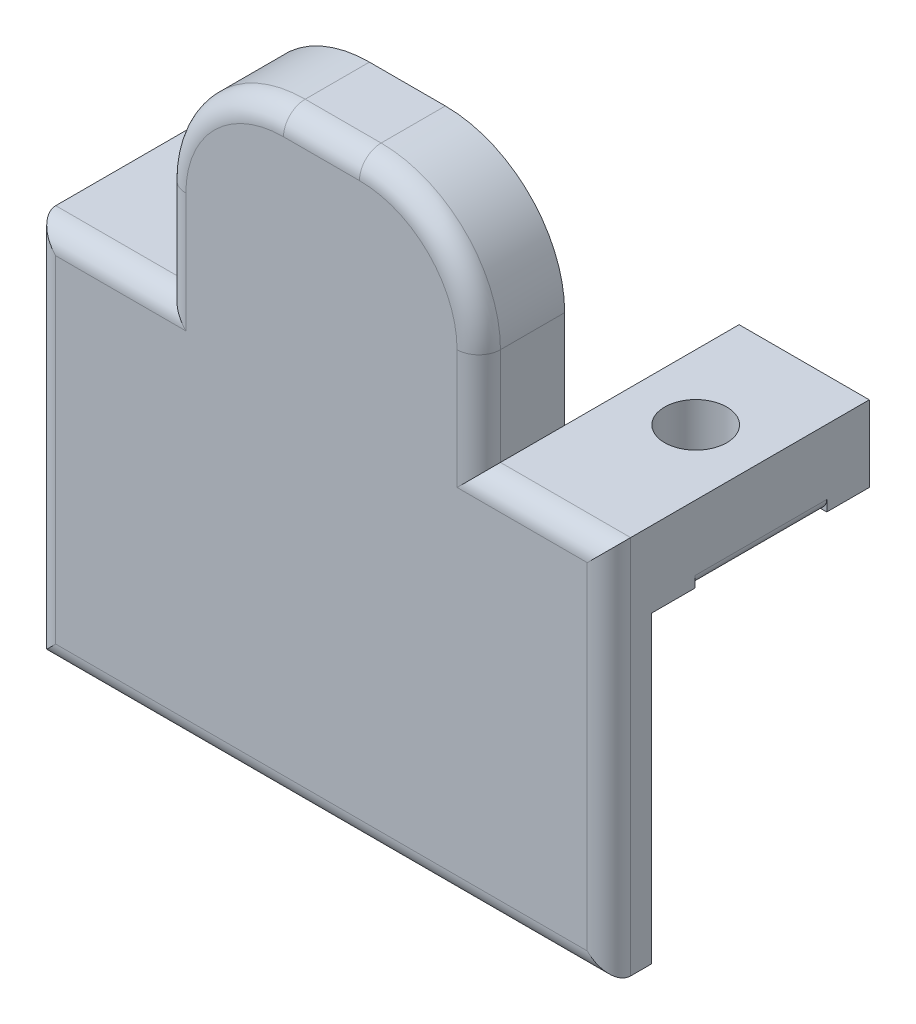
from build123d import *

# Parameters (mm, degrees)
SKETCH_1_W           = 53
SKETCH_1_H           = 35
EXTRUDE_1_DEPTH      = 3.92
SKETCH_2_W           = 12
SKETCH_2_H           = 27
CUT_EXTRUDE_1_DEPTH  = 4
EXTRUDE_2_DEPTH      = 16.08
EXTRUDE_2_DEPTH_BACK = 3.92
SKETCH_3_W           = 12
SKETCH_3_H           = 7
SKETCH_4_W           = 12
SKETCH_4_H           = 3.92
EXTRUDE_3_DEPTH      = 8
SKETCH_5_R           = 2.86
CUT_EXTRUDE_2_DEPTH  = 37.889245045
EXTRUDE_4_DEPTH      = 4
SKETCH_8_W           = 53
SKETCH_8_H           = 3.92
EXTRUDE_5_DEPTH      = 20
FILLET_1_R           = 2.5
FILLET_2_R           = 11
FILLET_3_R           = 1
FILLET_4_R           = 2
SKETCH_9_W           = 20.08
SKETCH_9_H           = 8
CUT_EXTRUDE_5_DEPTH  = 67.886593574
SKETCH_6_R           = 6
CUT_EXTRUDE_3_DEPTH  = 6.5


with BuildPart() as part:
    # 스케치1 → 보스-돌출1 (new body)
    with BuildSketch(Plane.XY):
        Rectangle(SKETCH_1_W, SKETCH_1_H)
    extrude(amount=EXTRUDE_1_DEPTH)

    # 스케치2 → 컷-돌출1 (cut)
    with BuildSketch(Plane.XY.offset(3.92)):
        with Locations((-20.5, 4)):
            Rectangle(SKETCH_2_W, SKETCH_2_H)
        with Locations((20.5, 4)):
            Rectangle(SKETCH_2_W, SKETCH_2_H)
    extrude(amount=-CUT_EXTRUDE_1_DEPTH, mode=Mode.SUBTRACT)

    # 스케치3 → 보스-돌출2 (add, two sides: drawn at the far end of the back side and taken through both)
    with BuildSketch(Plane(origin=(0, 0, 0), x_dir=(-1, 0, 0), z_dir=(0, 0, -1)).offset(-EXTRUDE_2_DEPTH_BACK)):
        with Locations((-20.5, -6)):
            Rectangle(SKETCH_3_W, SKETCH_3_H)
        with Locations((20.5, -6)):
            Rectangle(SKETCH_3_W, SKETCH_3_H)
    extrude(amount=EXTRUDE_2_DEPTH + EXTRUDE_2_DEPTH_BACK)

    # 스케치4 → 보스-돌출3 (add)
    with BuildSketch(Plane.XZ.offset(9.5)):
        with Locations((-20.5, -14.12)):
            Rectangle(SKETCH_4_W, SKETCH_4_H)
        with Locations((20.5, -14.12)):
            Rectangle(SKETCH_4_W, SKETCH_4_H)
    extrude(amount=EXTRUDE_3_DEPTH)

    # 스케치5 → 컷-돌출2 (cut, through all)
    with BuildSketch(Plane(origin=(0, -2.5, 0), x_dir=(1, 0, 0), z_dir=(0, 1, 0))):
        with Locations(Location((-20.5, 6.08, 0), (0, 0, 180))):
            Circle(SKETCH_5_R)
        with Locations((20.5, 6.08)):
            Circle(SKETCH_5_R)
    extrude(amount=-CUT_EXTRUDE_2_DEPTH, mode=Mode.SUBTRACT)

    # 스케치7 → 보스-돌출4 (add)
    with BuildSketch(Plane.XY.offset(3.92)):
        Polygon((-14.5, -2.5), (-26.5, -2.5), (-26.5, -17.5), (26.5, -17.5), (26.5, -2.5), (14.5, -2.5), (14.5, 17.5), (-14.5, 17.5), align=None)
    extrude(amount=EXTRUDE_4_DEPTH)

    # 스케치8 → 보스-돌출5 (add)
    with BuildSketch(Plane.XZ.offset(17.5)):
        with Locations((0, 5.96)):
            Rectangle(SKETCH_8_W, SKETCH_8_H)
    extrude(amount=EXTRUDE_5_DEPTH)

    # 필렛1
    fillet_1_edges = [part.edges().sort_by_distance(p)[0] for p in [
        (14.5, -9.5, -6.08),
        (-14.5, -9.5, -6.08),
    ]]
    fillet(fillet_1_edges, radius=FILLET_1_R)

    # 필렛2
    fillet_2_edges = [part.edges().sort_by_distance(p)[0] for p in [
        (-14.5, 17.5, 3.96),
        (14.5, 17.5, 3.96),
    ]]
    fillet(fillet_2_edges, radius=FILLET_2_R)

    # 필렛3
    fillet_3_edges = [part.edges().sort_by_distance(p)[0] for p in [
        (26.5, -9.5, -6.08),
        (-26.5, -9.5, -6.08),
    ]]
    fillet(fillet_3_edges, radius=FILLET_3_R)

    # 필렛4
    fillet_4_edges = [part.edges().sort_by_distance(p)[0] for p in [
        (-20.5, -2.5, 7.92),
        (-26.5, -20, 7.92),
        (26.5, -20, 7.92),
        (20.5, -2.5, 7.92),
        (14.5, 2, 7.92),
        (0, -37.5, 7.92),
        (-14.5, 2, 7.92),
        (0, 17.5, 7.92),
        (-11.278174593, 14.278174593, 7.92),
        (11.278174593, 14.278174593, 7.92),
    ]]
    fillet(fillet_4_edges, radius=FILLET_4_R)

    # 스케치9 → 컷-돌출5 (cut, through all)
    with BuildSketch(Plane(origin=(26.5, 0, 0), x_dir=(0, 0, -1), z_dir=(1, 0, 0))):
        with Locations((6.04, -13.5)):
            Rectangle(SKETCH_9_W, SKETCH_9_H)
    extrude(amount=-CUT_EXTRUDE_5_DEPTH, mode=Mode.SUBTRACT)

    # 스케치6 → 컷-돌출3 (cut)
    with BuildSketch(Plane.XY):
        with Locations(Location((0, 2.5, 0), (0, 0, 180))):
            Circle(SKETCH_6_R)
    extrude(amount=CUT_EXTRUDE_3_DEPTH, mode=Mode.SUBTRACT)


solid = part.part
